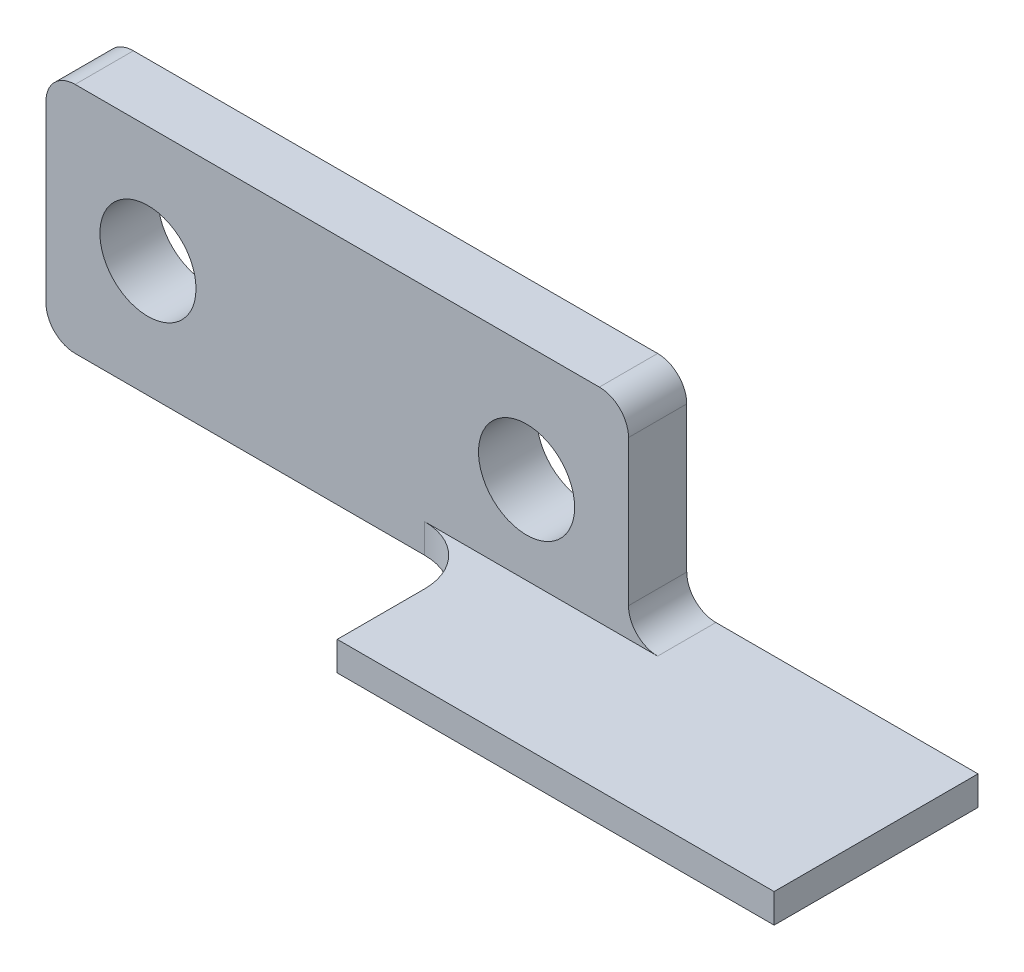
from build123d import *

# Parameters (mm, degrees)
SKETCH1_W                = 20
SKETCH1_H                = 8
BOSS_EXTRUDE1_DEPTH      = 2
BOSS_EXTRUDE2_DEPTH      = 5
BOSS_EXTRUDE2_DEPTH_BACK = 2
SKETCH2_W                = 15
SKETCH2_H                = 1
SKETCH3_R                = 1.65
CUT_EXTRUDE1_DEPTH       = 32.448370387
FILLET1_R                = 1
FILLET2_R                = 2


with BuildPart() as part:
    # Sketch1 → Boss-Extrude1 (new body)
    with BuildSketch(Plane.XY):
        with Locations((10, 4)):
            Rectangle(SKETCH1_W, SKETCH1_H)
    extrude(amount=BOSS_EXTRUDE1_DEPTH)

    # Sketch2 → Boss-Extrude2 (add, two sides: drawn at the far end of the back side and taken through both)
    with BuildSketch(Plane.XY.offset(2).offset(-BOSS_EXTRUDE2_DEPTH_BACK)):
        with Locations((22.5, 0.5)):
            Rectangle(SKETCH2_W, SKETCH2_H)
    extrude(amount=BOSS_EXTRUDE2_DEPTH + BOSS_EXTRUDE2_DEPTH_BACK)

    # Sketch3 → Cut-Extrude1 (cut, through all)
    with BuildSketch(Plane.XY.offset(2)):
        with Locations((3.5, 4)):
            Circle(SKETCH3_R)
        with Locations((16.5, 4)):
            Circle(SKETCH3_R)
    extrude(amount=-CUT_EXTRUDE1_DEPTH, mode=Mode.SUBTRACT)

    # Fillet1
    fillet1_edges = [part.edges().sort_by_distance(p)[0] for p in [
        (20, 1, 1),
        (0, 8, 1),
        (20, 8, 1),
        (0, 0, 1),
    ]]
    fillet(fillet1_edges, radius=FILLET1_R)

    # Fillet2
    fillet2_edges = [part.edges().sort_by_distance(p)[0] for p in [
        (15, 0.5, 2),
    ]]
    fillet(fillet2_edges, radius=FILLET2_R)


solid = part.part
